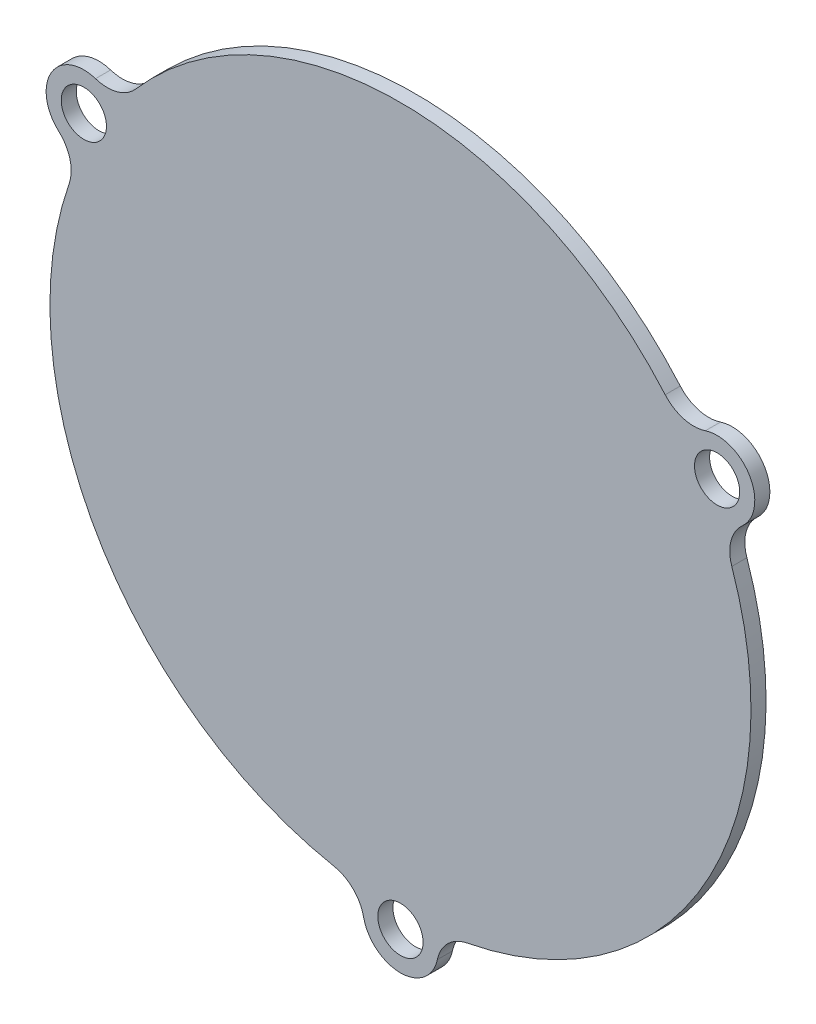
from build123d import *

# Parameters (mm, degrees)
ESQUISSE1_R          = 6
BASE_EXTRUSION_DEPTH = 4


with BuildPart() as part:
    # Esquisse1 → Base-Extrusion (new body)
    with BuildSketch(Plane.XY):
        with BuildLine():
            ThreePointArc((17.670233104, -91.305875288), (80.540362552, -46.5), (87.908324066, 30.350066885))
            ThreePointArc((87.908324066, 30.350066885), (87.680537041, 36.121878733), (90.682648098, 41.056757469))
            ThreePointArc((90.682648098, 41.056757469), (92.664718205, 53.5), (80.897519014, 58.005098201))
            ThreePointArc((80.897519014, 58.005098201), (75.122733136, 57.872633128), (70.238090962, 60.955808402))
            ThreePointArc((70.238090962, 60.955808402), (0, 93), (-70.238090962, 60.955808402))
            ThreePointArc((-70.238090962, 60.955808402), (-75.122733136, 57.872633128), (-80.897519014, 58.005098201))
            ThreePointArc((-80.897519014, 58.005098201), (-92.664718205, 53.5), (-90.682648098, 41.056757469))
            ThreePointArc((-90.682648098, 41.056757469), (-87.680537041, 36.121878733), (-87.908324066, 30.350066885))
            ThreePointArc((-87.908324066, 30.350066885), (-80.540362552, -46.5), (-17.670233104, -91.305875288))
            ThreePointArc((-17.670233104, -91.305875288), (-12.557803905, -93.994511862), (-9.785129084, -99.06185567))
            ThreePointArc((-9.785129084, -99.06185567), (0, -107), (9.785129084, -99.06185567))
            ThreePointArc((9.785129084, -99.06185567), (12.557803905, -93.994511862), (17.670233104, -91.305875288))
        make_face()
        with Locations((0, -97)):
            Circle(ESQUISSE1_R, mode=Mode.SUBTRACT)
        with Locations((84.004464167, 48.5)):
            Circle(ESQUISSE1_R, mode=Mode.SUBTRACT)
        with Locations((-84.004464167, 48.5)):
            Circle(ESQUISSE1_R, mode=Mode.SUBTRACT)
    extrude(amount=BASE_EXTRUSION_DEPTH)


solid = part.part
